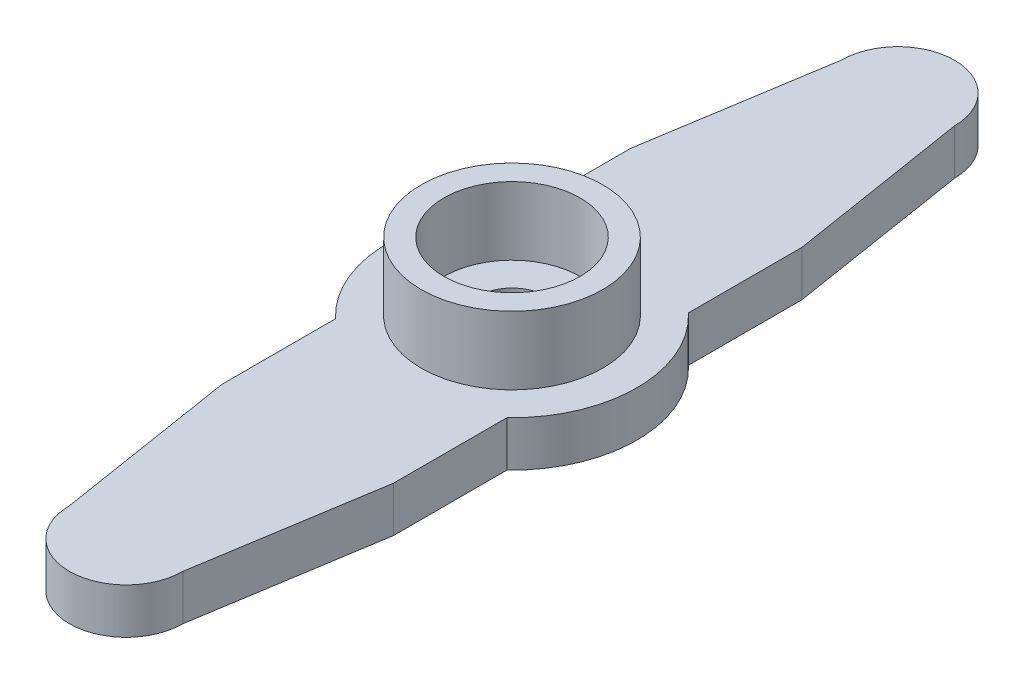
from build123d import *

# Parameters (mm, degrees)
SKETCH1_R           = 1.5
BOSS_EXTRUDE1_DEPTH = 2
SKETCH2_R           = 4
SKETCH2_R_2         = 3
BOSS_EXTRUDE2_DEPTH = 3


with BuildPart() as part:
    # Sketch1 → Boss-Extrude1 (new body)
    # profile 1 of 5: a face of its own
    with BuildSketch(Plane(origin=(0, 0, 0), x_dir=(1, 0, 0), z_dir=(0, 1, 0))):
        with BuildLine():
            Line((-3.774917218, 9), (-3.774917218, 4))
            ThreePointArc((-3.774917218, 4), (0, 5.5), (3.774917218, 4))
            Line((3.774917218, 4), (3.774917218, 9))
            Line((3.774917218, 9), (2.5, 17))
            ThreePointArc((2.5, 17), (0, 19.5), (-2.5, 17))
            Line((-2.5, 17), (-3.774917218, 9))
        make_face()
    # profile 2 of 5: a face of its own
    with BuildSketch(Plane(origin=(0, 0, 0), x_dir=(1, 0, 0), z_dir=(0, 1, 0))):
        with BuildLine():
            Line((3.774917218, 4), (-3.774917218, 4))
            ThreePointArc((-3.774917218, 4), (-5.5, 0), (-3.774917218, -4))
            Line((-3.774917218, -4), (3.774917218, -4))
            ThreePointArc((3.774917218, -4), (5.050348735, -2.178067412), (5.5, 0))
            ThreePointArc((5.5, 0), (5.050348735, 2.178067412), (3.774917218, 4))
        make_face()
        with Locations(Location((0, 0, 0), (0, 0, 270))):
            Circle(SKETCH1_R, mode=Mode.SUBTRACT)
    # profile 3 of 5: a face of its own
    with BuildSketch(Plane(origin=(0, 0, 0), x_dir=(1, 0, 0), z_dir=(0, 1, 0))):
        with BuildLine():
            ThreePointArc((3.774917218, 4), (0, 5.5), (-3.774917218, 4))
            Line((-3.774917218, 4), (3.774917218, 4))
        make_face()
    # profile 4 of 5: a face of its own
    with BuildSketch(Plane(origin=(0, 0, 0), x_dir=(1, 0, 0), z_dir=(0, 1, 0))):
        with BuildLine():
            Line((3.774917218, -4), (-3.774917218, -4))
            ThreePointArc((-3.774917218, -4), (0, -5.5), (3.774917218, -4))
        make_face()
    # profile 5 of 5: a face of its own
    with BuildSketch(Plane(origin=(0, 0, 0), x_dir=(1, 0, 0), z_dir=(0, 1, 0))):
        with BuildLine():
            ThreePointArc((3.774917218, -4), (0, -5.5), (-3.774917218, -4))
            Line((-3.774917218, -4), (-3.774917218, -9))
            Line((-3.774917218, -9), (-2.5, -17))
            ThreePointArc((-2.5, -17), (0, -19.5), (2.5, -17))
            Line((2.5, -17), (3.774917218, -9))
            Line((3.774917218, -9), (3.774917218, -4))
        make_face()
    extrude(amount=BOSS_EXTRUDE1_DEPTH)

    # Sketch2 → Boss-Extrude2 (add)
    with BuildSketch(Plane(origin=(0, 2, 0), x_dir=(1, 0, 0), z_dir=(0, 1, 0))):
        with Locations(Location((0, 0, 0), (0, 0, 270))):
            Circle(SKETCH2_R)
        with Locations(Location((0, 0, 0), (0, 0, 270))):
            Circle(SKETCH2_R_2, mode=Mode.SUBTRACT)
    extrude(amount=BOSS_EXTRUDE2_DEPTH)


solid = part.part
